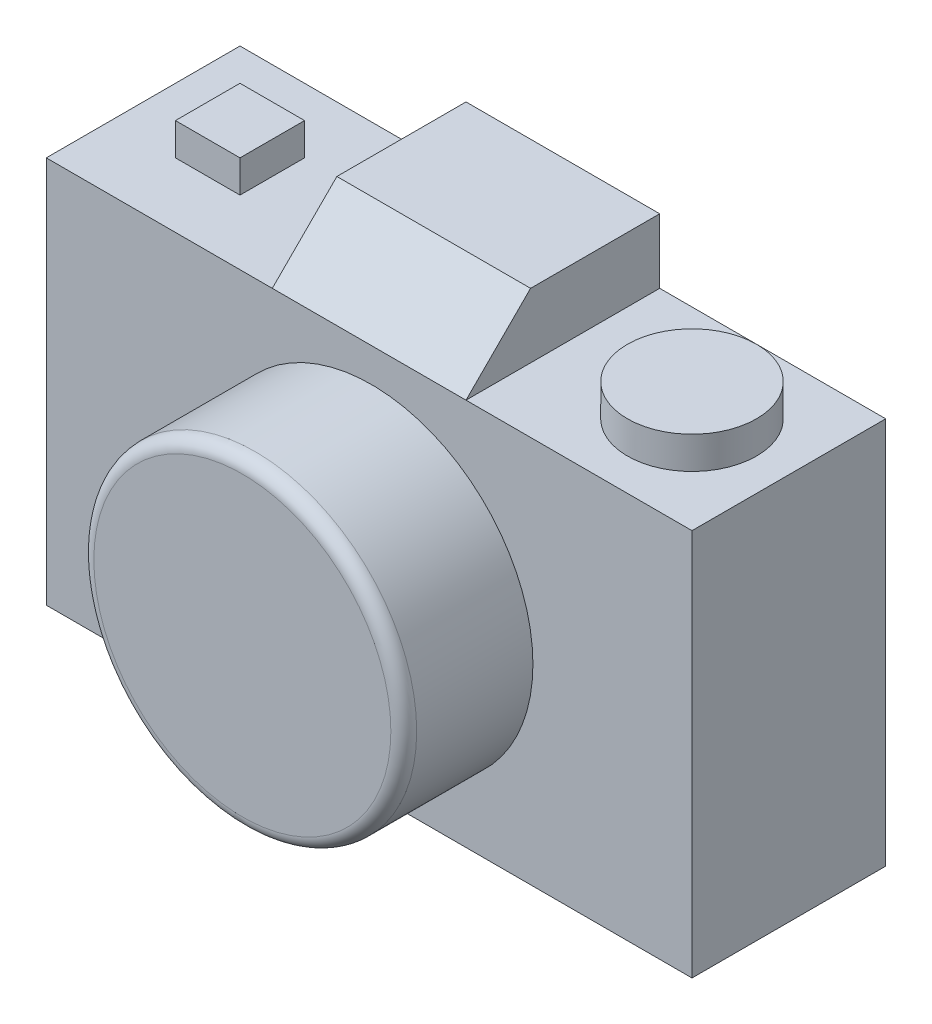
from build123d import *

# Parameters (mm, degrees)
SKETCH2_W           = 100
SKETCH2_H           = 60
BOSS_EXTRUDE1_DEPTH = 30
SKETCH4_R           = 25
BOSS_EXTRUDE2_DEPTH = 20
SKETCH6_R           = 10
SKETCH6_W           = 10
SKETCH6_H           = 10
BOSS_EXTRUDE3_DEPTH = 5
SKETCH8_W           = 30
SKETCH8_H           = 30
BOSS_EXTRUDE4_DEPTH = 10
CHAMFER2_SIZE       = 10
FILLET1_R           = 2


with BuildPart() as part:
    # Sketch2 → Boss-Extrude1 (new body)
    with BuildSketch(Plane.XY):
        with Locations((2.802056555, -2.390745501)):
            Rectangle(SKETCH2_W, SKETCH2_H)
    extrude(amount=BOSS_EXTRUDE1_DEPTH)

    # Sketch4 → Boss-Extrude2 (add)
    with BuildSketch(Plane.XY.offset(30)):
        with Locations((3.165713288, -2.608939541)):
            Circle(SKETCH4_R)
    extrude(amount=BOSS_EXTRUDE2_DEPTH)

    # Sketch6 → Boss-Extrude3 (add)
    with BuildSketch(Plane(origin=(0, 27.609254499, 0), x_dir=(1, 0, 0), z_dir=(0, 1, 0))):
        with Locations((37.802056555, -15)):
            Circle(SKETCH6_R)
        with Locations((-32.197943445, -15)):
            Rectangle(SKETCH6_W, SKETCH6_H)
    extrude(amount=BOSS_EXTRUDE3_DEPTH)

    # Sketch8 → Boss-Extrude4 (add)
    with BuildSketch(Plane(origin=(0, 27.609254499, 0), x_dir=(1, 0, 0), z_dir=(0, 1, 0))):
        with Locations((2.802056555, -15)):
            Rectangle(SKETCH8_W, SKETCH8_H)
    extrude(amount=BOSS_EXTRUDE4_DEPTH)

    # Chamfer2
    chamfer2_edges = [part.edges().sort_by_distance(p)[0] for p in [
        (2.802056555, 37.609254499, 30),
    ]]
    chamfer(chamfer2_edges, length=CHAMFER2_SIZE)

    # Fillet1
    fillet1_edges = [part.edges().sort_by_distance(p)[0] for p in [
        (-21.834286712, -2.608939541, 50),
    ]]
    fillet(fillet1_edges, radius=FILLET1_R)


solid = part.part
